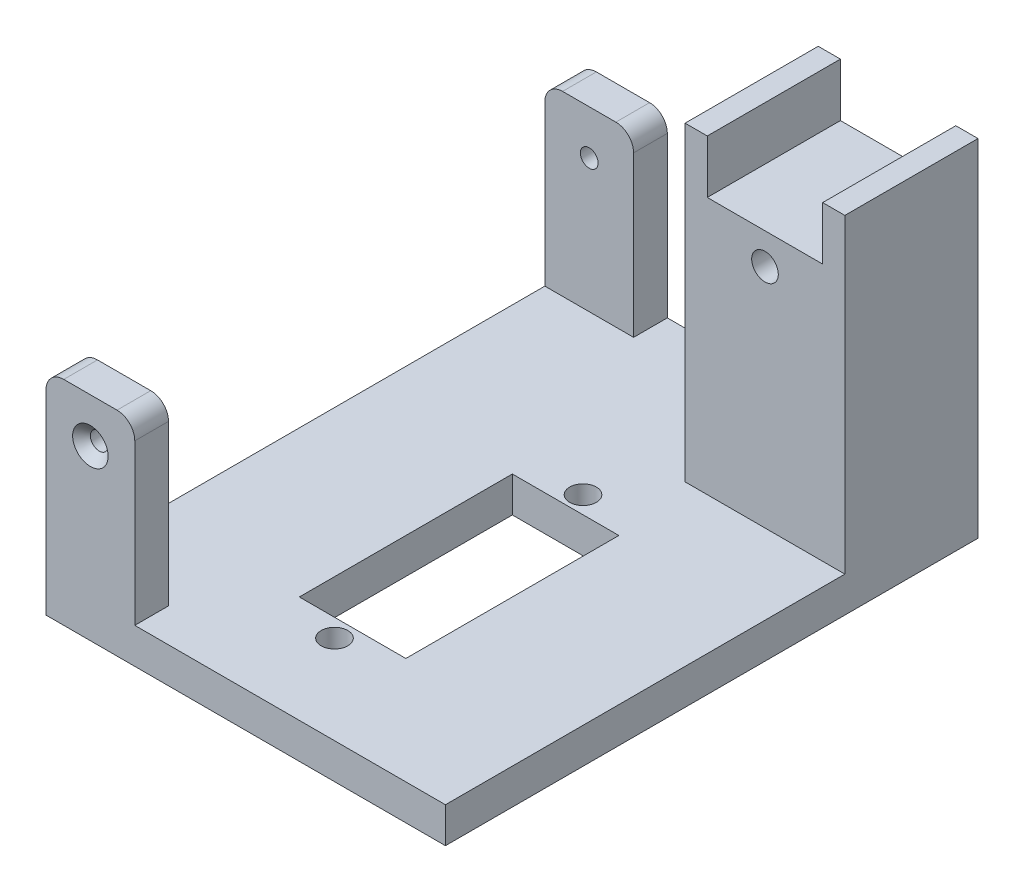
from build123d import *

# Parameters (mm, degrees)
SKETCH1_W           = 45
SKETCH1_H           = 60
BOSS_EXTRUDE1_DEPTH = 4
SKETCH2_W           = 10
SKETCH2_H           = 3.8
BOSS_EXTRUDE2_DEPTH = 20
CUT_EXTRUDE1_REACH  = 70.427
SKETCH3_R           = 1
CUT_EXTRUDE2_REACH  = 70.427
SKETCH4_R           = 1
SKETCH5_W           = 18
SKETCH5_H           = 15
BOSS_EXTRUDE3_DEPTH = 35
SKETCH6_W           = 13
SKETCH6_H           = 20
CUT_EXTRUDE3_DEPTH  = 6
CUT_EXTRUDE4_REACH  = 77.015
SKETCH7_R           = 1.5
FILLET1_R           = 2
CHAMFER2_SIZE       = 1
CHAMFER3_SIZE       = 1
CUT_EXTRUDE5_REACH  = 56.104
SKETCH8_R           = 1.5
SKETCH8_W           = 12
SKETCH8_H           = 24


with BuildPart() as part:
    # Sketch1 → Boss-Extrude1 (new body)
    with BuildSketch(Plane(origin=(0, 0, 0), x_dir=(1, 0, 0), z_dir=(0, 1, 0))):
        Rectangle(SKETCH1_W, SKETCH1_H)
    extrude(amount=BOSS_EXTRUDE1_DEPTH)

    # Sketch2 → Boss-Extrude2 (add)
    with BuildSketch(Plane(origin=(0, 4, 0), x_dir=(1, 0, 0), z_dir=(0, 1, 0))):
        with Locations((-17.5, 28.1)):
            Rectangle(SKETCH2_W, SKETCH2_H)
        with Locations((-17.5, -28.1)):
            Rectangle(SKETCH2_W, SKETCH2_H)
    extrude(amount=BOSS_EXTRUDE2_DEPTH)

    # Sketch3 → Cut-Extrude1 (cut, up to next)
    with BuildSketch(Plane.XY.offset(30), mode=Mode.PRIVATE) as cut_extrude1_sk1:
        with Locations((-17.5, 19)):
            Circle(SKETCH3_R)
    cut_extrude1_tool1 = extrude(cut_extrude1_sk1.sketch, amount=-CUT_EXTRUDE1_REACH, mode=Mode.PRIVATE) & part.part
    add(cut_extrude1_tool1.solids().sort_by_distance((-17.5, 19, 30))[0], mode=Mode.SUBTRACT)

    # Sketch4 → Cut-Extrude2 (cut, up to next)
    with BuildSketch(Plane(origin=(0, 0, -30), x_dir=(-1, 0, 0), z_dir=(0, 0, -1)), mode=Mode.PRIVATE) as cut_extrude2_sk1:
        with Locations(Location((17.5, 19, 0), (0, 0, 180))):
            Circle(SKETCH4_R)
    cut_extrude2_tool1 = extrude(cut_extrude2_sk1.sketch, amount=-CUT_EXTRUDE2_REACH, mode=Mode.PRIVATE) & part.part
    add(cut_extrude2_tool1.solids().sort_by_distance((-17.5, 19, -30))[0], mode=Mode.SUBTRACT)

    # Sketch5 → Boss-Extrude3 (add)
    with BuildSketch(Plane(origin=(0, 4, 0), x_dir=(1, 0, 0), z_dir=(0, 1, 0))):
        with Locations((13.5, 22.5)):
            Rectangle(SKETCH5_W, SKETCH5_H)
    extrude(amount=BOSS_EXTRUDE3_DEPTH)

    # Sketch6 → Cut-Extrude3 (cut)
    with BuildSketch(Plane(origin=(0, 39, 0), x_dir=(1, 0, 0), z_dir=(0, 1, 0))):
        with Locations((13.5, 20)):
            Rectangle(SKETCH6_W, SKETCH6_H)
    extrude(amount=-CUT_EXTRUDE3_DEPTH, mode=Mode.SUBTRACT)

    # Sketch7 → Cut-Extrude4 (cut, up to next)
    with BuildSketch(Plane(origin=(0, 0, -30), x_dir=(-1, 0, 0), z_dir=(0, 0, -1)), mode=Mode.PRIVATE) as cut_extrude4_sk1:
        with Locations((-13.5, 29.5)):
            Circle(SKETCH7_R)
    cut_extrude4_tool1 = extrude(cut_extrude4_sk1.sketch, amount=-CUT_EXTRUDE4_REACH, mode=Mode.PRIVATE) & part.part
    add(cut_extrude4_tool1.solids().sort_by_distance((13.5, 29.5, -30))[0], mode=Mode.SUBTRACT)

    # Fillet1
    fillet1_edges = [part.edges().sort_by_distance(p)[0] for p in [
        (-12.5, 24, -28.1),
        (-22.5, 24, -28.1),
        (-12.5, 24, 28.1),
        (-22.5, 24, 28.1),
    ]]
    fillet(fillet1_edges, radius=FILLET1_R)

    # Chamfer2
    chamfer2_edges = [part.edges().sort_by_distance(p)[0] for p in [
        (-18.5, 19, -30),
    ]]
    chamfer(chamfer2_edges, length=CHAMFER2_SIZE)

    # Chamfer3
    chamfer3_edges = [part.edges().sort_by_distance(p)[0] for p in [
        (-18.5, 19, 30),
    ]]
    chamfer(chamfer3_edges, length=CHAMFER3_SIZE)

    # Sketch8 → Cut-Extrude5 (cut, up to next)
    with BuildSketch(Plane.XZ, mode=Mode.PRIVATE) as cut_extrude5_sk1:
        with Locations(Location((0, -8, 0), (0, 0, 270))):
            Circle(SKETCH8_R)
    cut_extrude5_tool1 = extrude(cut_extrude5_sk1.sketch, amount=-CUT_EXTRUDE5_REACH, mode=Mode.PRIVATE) & part.part
    # Sketch8 → Cut-Extrude5 (cut, up to next)
    with BuildSketch(Plane.XZ, mode=Mode.PRIVATE) as cut_extrude5_sk2:
        with Locations(Location((0, 20, 0), (0, 0, 270))):
            Circle(SKETCH8_R)
    cut_extrude5_tool2 = extrude(cut_extrude5_sk2.sketch, amount=-CUT_EXTRUDE5_REACH, mode=Mode.PRIVATE) & part.part
    # Sketch8 → Cut-Extrude5 (cut, up to next)
    with BuildSketch(Plane.XZ, mode=Mode.PRIVATE) as cut_extrude5_sk3:
        with Locations((0, 5.960185671)):
            Rectangle(SKETCH8_W, SKETCH8_H)
    cut_extrude5_tool3 = extrude(cut_extrude5_sk3.sketch, amount=-CUT_EXTRUDE5_REACH, mode=Mode.PRIVATE) & part.part
    add(cut_extrude5_tool1.solids().sort_by_distance((0, 0, -8))[0], mode=Mode.SUBTRACT)
    add(cut_extrude5_tool2.solids().sort_by_distance((0, 0, 20))[0], mode=Mode.SUBTRACT)
    add(cut_extrude5_tool3.solids().sort_by_distance((0, 0, 5.960186))[0], mode=Mode.SUBTRACT)


solid = part.part
